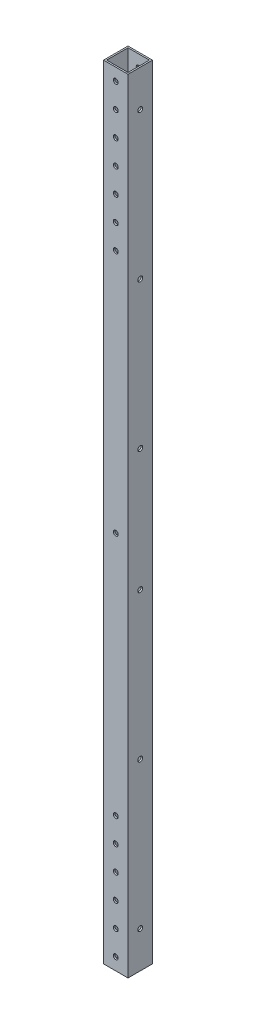
from build123d import *

# Parameters (mm, degrees)
SKETCH1_W                  = 25.4
SKETCH1_H                  = 25.4
SKETCH1_W_2                = 22.225
SKETCH1_H_2                = 22.225
BOSS_EXTRUDE1_DEPTH        = 812.8
F_7_0_201_DIAMETER_HOLE1_D = 5.1054
F_7_0_201_DIAMETER_HOLE2_D = 5.1054


with BuildPart() as part:
    # Sketch1 → Boss-Extrude1 (new body)
    with BuildSketch(Plane(origin=(0, 0, 0), x_dir=(1, 0, 0), z_dir=(0, 1, 0))):
        Rectangle(SKETCH1_W, SKETCH1_H)
        Rectangle(SKETCH1_W_2, SKETCH1_H_2, mode=Mode.SUBTRACT)
    extrude(amount=BOSS_EXTRUDE1_DEPTH)

    # #7 (0.201) Diameter Hole1 (through all)
    with Locations(Plane.XY.offset(12.7)):
        with Locations((0, 12.7), (0, 38.1), (0, 63.5), (0, 88.9), (0, 114.3), (0, 139.7), (0, 393.7), (0, 647.7), (0, 673.1), (0, 698.5), (0, 723.9), (0, 749.3), (0, 774.7), (0, 800.1)):
            Hole(F_7_0_201_DIAMETER_HOLE1_D / 2)

    # #7 (0.201) Diameter Hole2 (through all)
    with Locations(Plane(origin=(12.7, 0, 0), x_dir=(0, 0, -1), z_dir=(1, 0, 0))):
        with Locations((0, 38.1), (0, 190.5), (0, 342.9), (0, 469.9), (0, 622.3), (0, 774.7)):
            Hole(F_7_0_201_DIAMETER_HOLE2_D / 2)


solid = part.part
